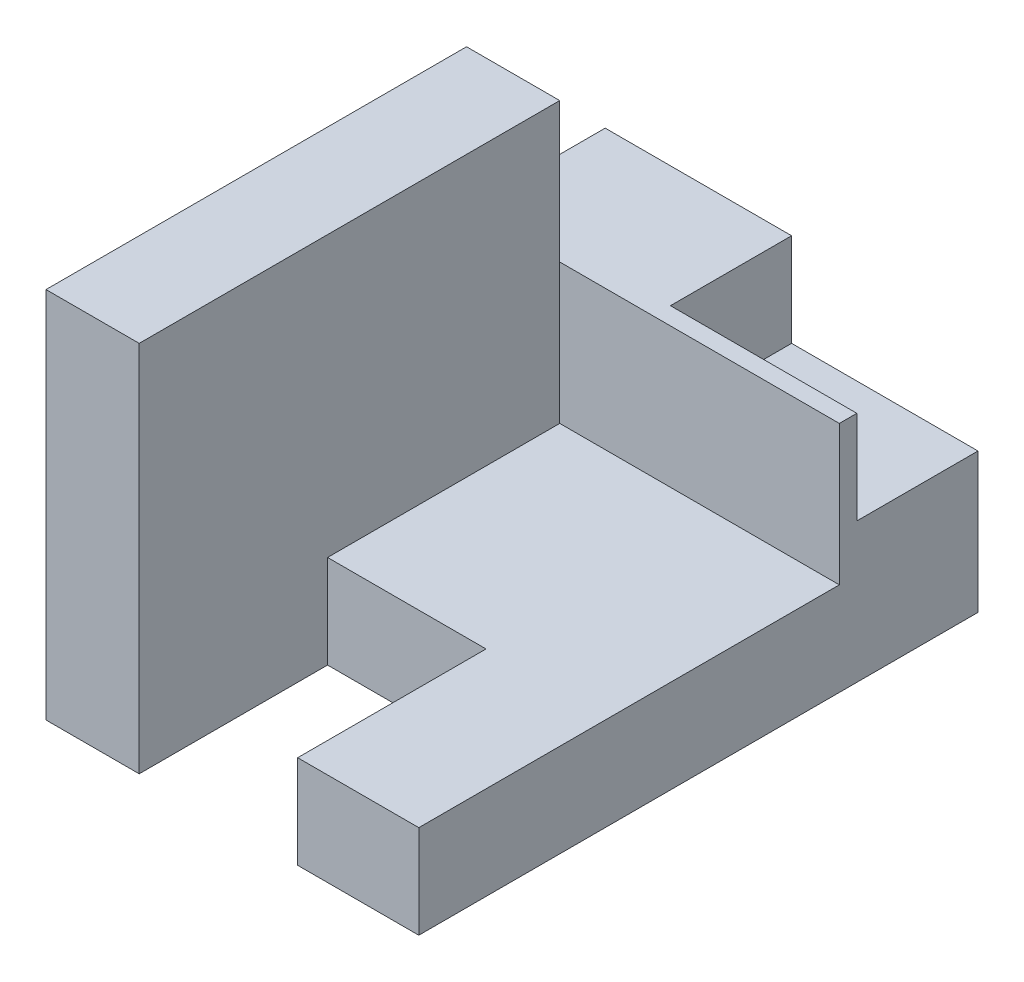
from build123d import *

# Parameters (mm, degrees)
SKETCH1_W           = 40
SKETCH1_H           = 40
BOSS_EXTRUDE1_DEPTH = 60
SKETCH2_W           = 17.003973312
SKETCH2_H           = 20.210355484
CUT_EXTRUDE1_DEPTH  = 50
SKETCH3_W           = 30
SKETCH3_H           = 45.122215106
CUT_EXTRUDE2_DEPTH  = 30
SKETCH4_W           = 40
SKETCH4_H           = 14.877784894
CUT_EXTRUDE3_DEPTH  = 15
SKETCH5_W           = 20
SKETCH5_H           = 13
CUT_EXTRUDE4_DEPTH  = 10


with BuildPart() as part:
    # Sketch1 → Boss-Extrude1 (new body)
    with BuildSketch(Plane.XY):
        with Locations((20, 20)):
            Rectangle(SKETCH1_W, SKETCH1_H)
    extrude(amount=BOSS_EXTRUDE1_DEPTH)

    # Sketch2 → Cut-Extrude1 (cut)
    with BuildSketch(Plane(origin=(0, 40, 0), x_dir=(1, 0, 0), z_dir=(0, 1, 0))):
        with Locations((18.501986656, -49.894822258)):
            Rectangle(SKETCH2_W, SKETCH2_H)
    extrude(amount=-CUT_EXTRUDE1_DEPTH, mode=Mode.SUBTRACT)

    # Sketch3 → Cut-Extrude2 (cut)
    with BuildSketch(Plane(origin=(0, 40, 0), x_dir=(1, 0, 0), z_dir=(0, 1, 0))):
        with Locations((25, -37.438892447)):
            Rectangle(SKETCH3_W, SKETCH3_H)
    extrude(amount=-CUT_EXTRUDE2_DEPTH, mode=Mode.SUBTRACT)

    # Sketch4 → Cut-Extrude3 (cut)
    with BuildSketch(Plane(origin=(0, 40, 0), x_dir=(1, 0, 0), z_dir=(0, 1, 0))):
        with Locations((20, -7.438892447)):
            Rectangle(SKETCH4_W, SKETCH4_H)
    extrude(amount=-CUT_EXTRUDE3_DEPTH, mode=Mode.SUBTRACT)

    # Sketch5 → Cut-Extrude4 (cut)
    with BuildSketch(Plane(origin=(0, 25, 0), x_dir=(1, 0, 0), z_dir=(0, 1, 0))):
        with Locations((30, -6.5)):
            Rectangle(SKETCH5_W, SKETCH5_H)
    extrude(amount=-CUT_EXTRUDE4_DEPTH, mode=Mode.SUBTRACT)


solid = part.part
